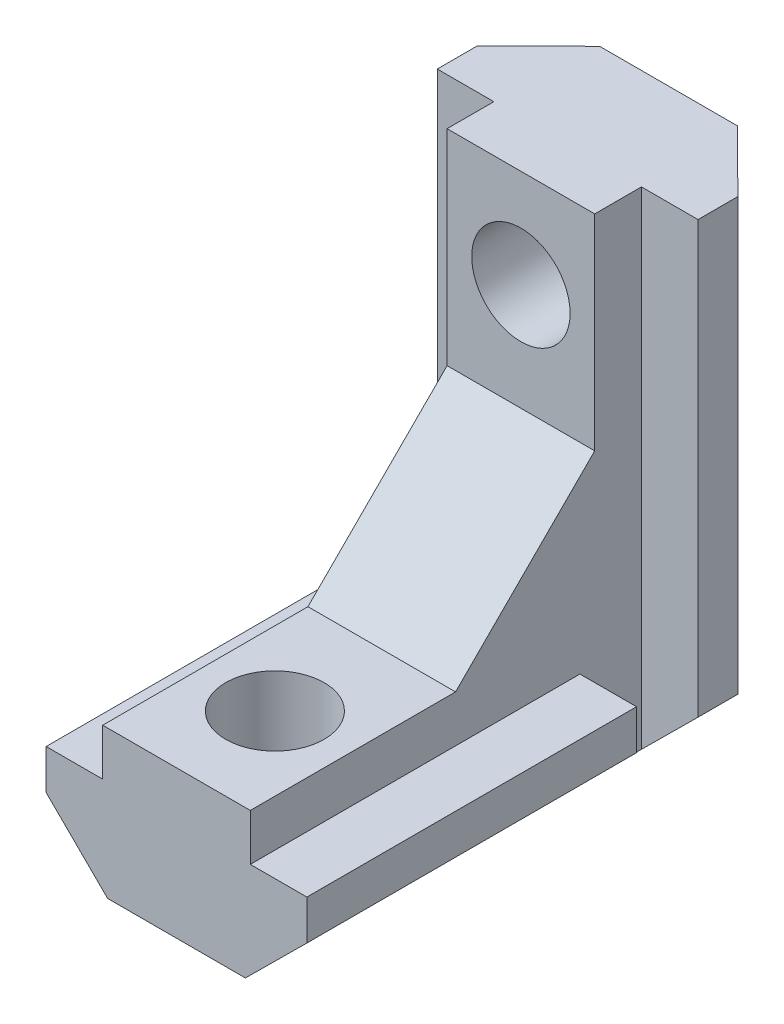
from build123d import *

# Parameters (mm, degrees)
BOSS_EXTRUDE1_DEPTH     = 20
BOSS_EXTRUDE2_DEPTH     = 20
CUT_EXTRUDE3_DEPTH      = 29.776552955
CUT_EXTRUDE3_DEPTH_BACK = 29.776552955
CUT_EXTRUDE4_DEPTH      = 29.776552955
BOSS_EXTRUDE3_DEPTH     = 3
CUT_EXTRUDE5_DEPTH      = 29.776552955
SKETCH11_R              = 2
CUT_EXTRUDE6_DEPTH      = 25.98179337
SKETCH12_R              = 2
CUT_EXTRUDE7_DEPTH      = 10


with BuildPart() as part:
    # Sketch1 → Boss-Extrude1 (new body)
    with BuildSketch(Plane.XY):
        Polygon((-3, 6), (3, 6), (3, 4.1), (5.3, 4.1), (5.3, 2.48), (2.8, 0), (-2.8, 0), (-5.3, 2.48), (-5.3, 4.1), (-3, 4.1), align=None)
    extrude(amount=BOSS_EXTRUDE1_DEPTH)

    # Sketch2 → Boss-Extrude2 (add)
    with BuildSketch(Plane(origin=(-0.009718496, 0, -0.066979448), x_dir=(-1, 0, 0), z_dir=(0, 1, 0))):
        Polygon((-3.009718496, 6.066979448), (2.990281504, 6.066979448), (2.990281504, 4.166979448), (5.290281504, 4.166979448), (5.290281504, 2.546979448), (2.790281504, 0.066979448), (-2.809718496, 0.066979448), (-5.309718496, 2.546979448), (-5.309718496, 4.166979448), (-3.009718496, 4.166979448), align=None)
    extrude(amount=BOSS_EXTRUDE2_DEPTH)

    # Sketch3 → Cut-Extrude3 (cut, two sides: drawn at the far end of the back side and taken through both)
    with BuildSketch(Plane(origin=(0, 0, 0), x_dir=(1, 0, 0), z_dir=(0, 1, 0)).offset(-CUT_EXTRUDE3_DEPTH_BACK)):
        Polygon((-2.8, 0), (-5.3, -2.48), (-5.3, 0), align=None)
        Polygon((5.3, -2.48), (5.3, 0), (2.8, 0), align=None)
    extrude(amount=CUT_EXTRUDE3_DEPTH + CUT_EXTRUDE3_DEPTH_BACK, mode=Mode.SUBTRACT)

    # Sketch4 → Cut-Extrude4 (cut, through all)
    with BuildSketch(Plane.XY):
        Polygon((2.8, 0), (3, 0), (5.3, 0), (5.3, 2.48), align=None)
        Polygon((-5.3, 2.48), (-5.3, 0), (-3, 0), (-2.8, 0), align=None)
    extrude(amount=CUT_EXTRUDE4_DEPTH, mode=Mode.SUBTRACT)

    # Sketch5 → Boss-Extrude3 (add, symmetric)
    with BuildSketch(Plane(origin=(0, 0, 0), x_dir=(0, 0, -1), z_dir=(1, 0, 0))):
        Polygon((-11.656854249, 6), (-6, 6), (-6, 11.656854249), align=None)
    extrude(amount=BOSS_EXTRUDE3_DEPTH, both=True)

    # Sketch10 → Cut-Extrude5 (cut, through all)
    with BuildSketch(Plane(origin=(0, 0, 0), x_dir=(1, 0, 0), z_dir=(0, 1, 0))):
        Polygon((-5.3, -4.1), (-3, -4.1), (-3, -6), (-3, -6.6), (-5.3, -6.6), align=None)
        Polygon((3, -6), (3, -4.1), (5.3, -4.1), (5.3, -6.6), (3, -6.6), align=None)
    extrude(amount=CUT_EXTRUDE5_DEPTH, mode=Mode.SUBTRACT)

    # Sketch11 → Cut-Extrude6 (cut, through all)
    with BuildSketch(Plane.XY.offset(6)):
        with Locations((0, 16)):
            Circle(SKETCH11_R)
    extrude(amount=-CUT_EXTRUDE6_DEPTH, mode=Mode.SUBTRACT)

    # Sketch12 → Cut-Extrude7 (cut)
    with BuildSketch(Plane(origin=(0, 6, 0), x_dir=(1, 0, 0), z_dir=(0, 1, 0))):
        with Locations(Location((0, -16, 0), (0, 0, 270))):
            Circle(SKETCH12_R)
    extrude(amount=-CUT_EXTRUDE7_DEPTH, mode=Mode.SUBTRACT)


solid = part.part
